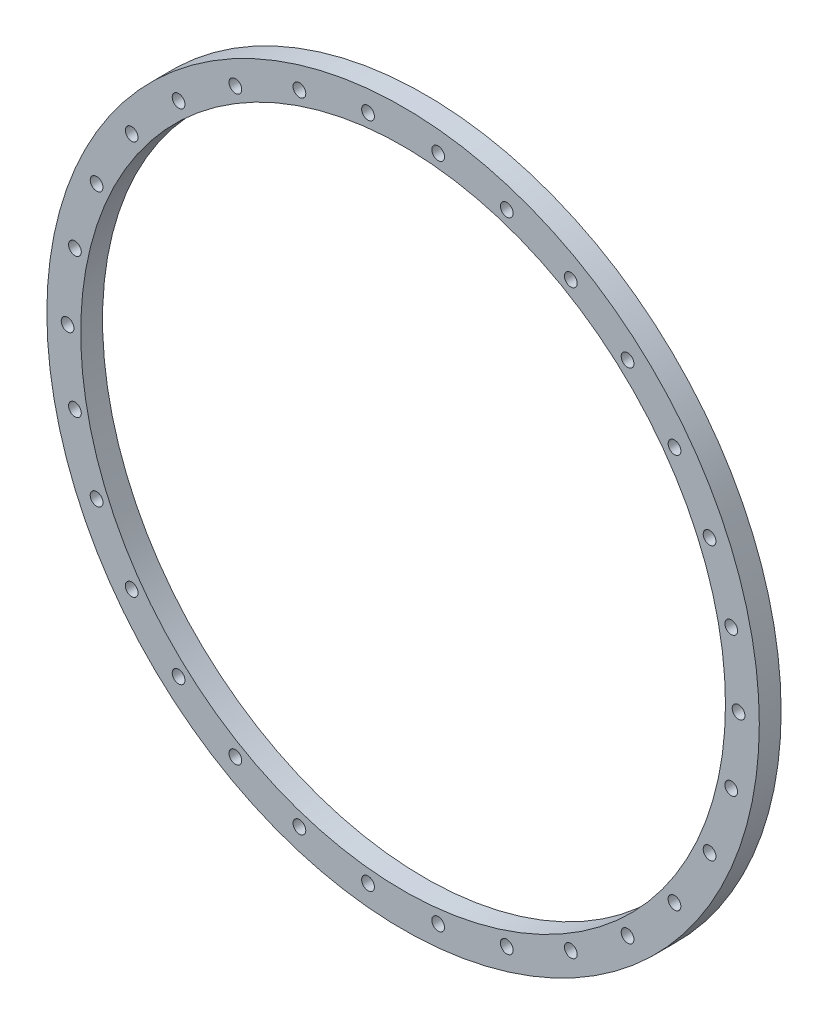
from build123d import *

# Parameters (mm, degrees)
ESQUISSE1_R        = 489.5
ESQUISSE1_R_2      = 443
ESQUISSE1_R_3      = 8.75
BOSS_EXTRU_1_DEPTH = 30


with BuildPart() as part:
    # Esquisse1 → Boss.-Extru.1 (new body)
    with BuildSketch(Plane.XY):
        Circle(ESQUISSE1_R)
        Circle(ESQUISSE1_R_2, mode=Mode.SUBTRACT)
        with Locations((-461, 0)):
            Circle(ESQUISSE1_R_3, mode=Mode.SUBTRACT)
        with Locations((-450.926043938, 95.847289467)):
            Circle(ESQUISSE1_R_3, mode=Mode.SUBTRACT)
        with Locations((-421.144455973, 187.505592458)):
            Circle(ESQUISSE1_R_3, mode=Mode.SUBTRACT)
        with Locations((-372.956834407, 270.969001307)):
            Circle(ESQUISSE1_R_3, mode=Mode.SUBTRACT)
        with Locations((-308.469209531, 342.589764545)):
            Circle(ESQUISSE1_R_3, mode=Mode.SUBTRACT)
        with Locations((-230.5, 399.237711145)):
            Circle(ESQUISSE1_R_3, mode=Mode.SUBTRACT)
        with Locations((-142.456834407, 438.437054012)):
            Circle(ESQUISSE1_R_3, mode=Mode.SUBTRACT)
        with Locations((-48.187621566, 458.474593765)):
            Circle(ESQUISSE1_R_3, mode=Mode.SUBTRACT)
        with Locations((48.187621566, 458.474593765)):
            Circle(ESQUISSE1_R_3, mode=Mode.SUBTRACT)
        with Locations((142.456834407, 438.437054012)):
            Circle(ESQUISSE1_R_3, mode=Mode.SUBTRACT)
        with Locations((230.5, 399.237711145)):
            Circle(ESQUISSE1_R_3, mode=Mode.SUBTRACT)
        with Locations((308.469209531, 342.589764545)):
            Circle(ESQUISSE1_R_3, mode=Mode.SUBTRACT)
        with Locations((372.956834407, 270.969001307)):
            Circle(ESQUISSE1_R_3, mode=Mode.SUBTRACT)
        with Locations((421.144455973, 187.505592458)):
            Circle(ESQUISSE1_R_3, mode=Mode.SUBTRACT)
        with Locations((450.926043938, 95.847289467)):
            Circle(ESQUISSE1_R_3, mode=Mode.SUBTRACT)
        with Locations((461, 0)):
            Circle(ESQUISSE1_R_3, mode=Mode.SUBTRACT)
        with Locations((450.926043938, -95.847289467)):
            Circle(ESQUISSE1_R_3, mode=Mode.SUBTRACT)
        with Locations((421.144455973, -187.505592458)):
            Circle(ESQUISSE1_R_3, mode=Mode.SUBTRACT)
        with Locations((372.956834407, -270.969001307)):
            Circle(ESQUISSE1_R_3, mode=Mode.SUBTRACT)
        with Locations((308.469209531, -342.589764545)):
            Circle(ESQUISSE1_R_3, mode=Mode.SUBTRACT)
        with Locations((230.5, -399.237711145)):
            Circle(ESQUISSE1_R_3, mode=Mode.SUBTRACT)
        with Locations((142.456834407, -438.437054012)):
            Circle(ESQUISSE1_R_3, mode=Mode.SUBTRACT)
        with Locations((48.187621566, -458.474593765)):
            Circle(ESQUISSE1_R_3, mode=Mode.SUBTRACT)
        with Locations((-48.187621566, -458.474593765)):
            Circle(ESQUISSE1_R_3, mode=Mode.SUBTRACT)
        with Locations((-142.456834407, -438.437054012)):
            Circle(ESQUISSE1_R_3, mode=Mode.SUBTRACT)
        with Locations((-230.5, -399.237711145)):
            Circle(ESQUISSE1_R_3, mode=Mode.SUBTRACT)
        with Locations((-308.469209531, -342.589764545)):
            Circle(ESQUISSE1_R_3, mode=Mode.SUBTRACT)
        with Locations((-372.956834407, -270.969001307)):
            Circle(ESQUISSE1_R_3, mode=Mode.SUBTRACT)
        with Locations((-421.144455973, -187.505592458)):
            Circle(ESQUISSE1_R_3, mode=Mode.SUBTRACT)
        with Locations((-450.926043938, -95.847289467)):
            Circle(ESQUISSE1_R_3, mode=Mode.SUBTRACT)
    extrude(amount=BOSS_EXTRU_1_DEPTH)


solid = part.part
